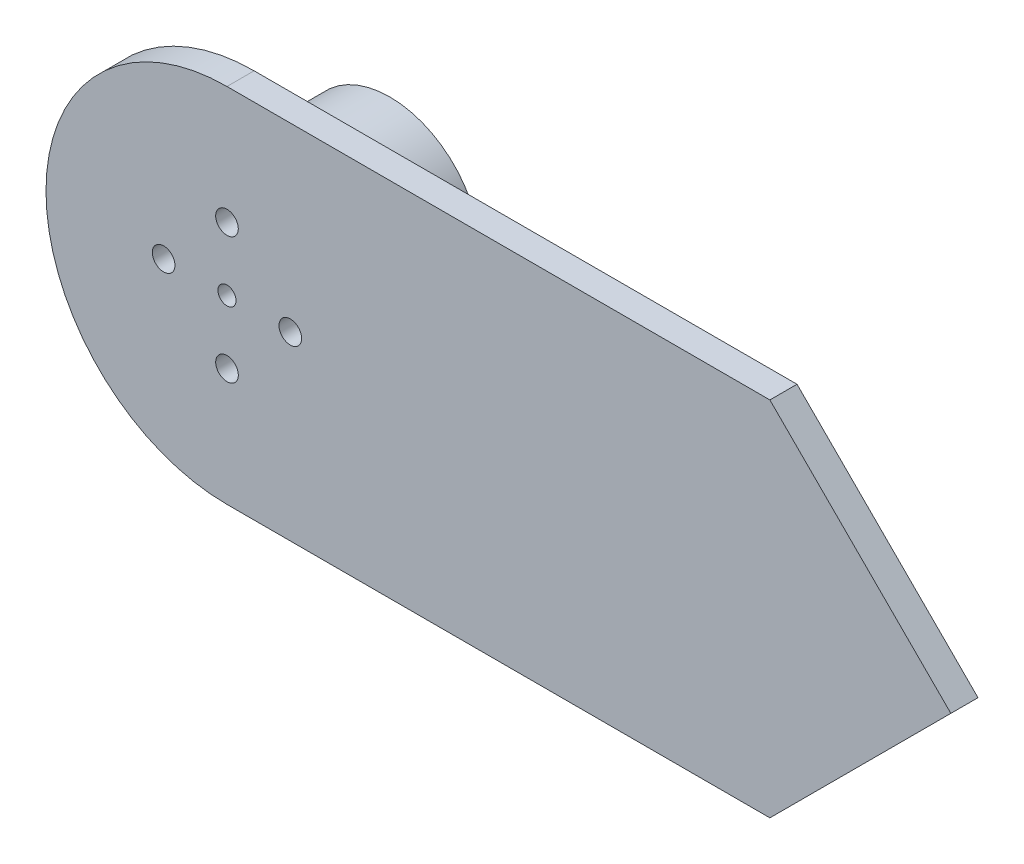
from build123d import *

# Parameters (mm, degrees)
BOSS_EXTRUDE1_DEPTH   = 3
CUT_EXTRUDE1_REACH    = 84.517
SKETCH2_R             = 1
SKETCH2_R_2           = 1.25
SKETCH3_R             = 10
BOSS_EXTRUDE2_DEPTH   = 15
BODY_MOVE_COPY2_ANGLE = 90


with BuildPart() as part:
    # Sketch1 → Boss-Extrude1 (new body)
    with BuildSketch(Plane(origin=(0, 0, 0), x_dir=(1, 0, 0), z_dir=(0, 1, 0))):
        with BuildLine():
            Line((60, -20), (0, -20))
            ThreePointArc((0, -20), (-20, 0), (0, 20))
            Line((0, 20), (60, 20))
            Line((60, 20), (80, 0))
            Line((80, 0), (60, -20))
        make_face()
    extrude(amount=BOSS_EXTRUDE1_DEPTH)

    # Sketch2 → Cut-Extrude1 (cut, up to next)
    with BuildSketch(Plane(origin=(0, 3, 0), x_dir=(1, 0, 0), z_dir=(0, 1, 0)), mode=Mode.PRIVATE) as cut_extrude1_sk1:
        with Locations(Location((0, 0, 0), (0, 0, 270))):
            Circle(SKETCH2_R)
    cut_extrude1_tool1 = extrude(cut_extrude1_sk1.sketch, amount=-CUT_EXTRUDE1_REACH, mode=Mode.PRIVATE) & part.part
    # Sketch2 → Cut-Extrude1 (cut, up to next)
    with BuildSketch(Plane(origin=(0, 3, 0), x_dir=(1, 0, 0), z_dir=(0, 1, 0)), mode=Mode.PRIVATE) as cut_extrude1_sk2:
        with Locations(Location((0, 7, 0), (0, 0, 270))):
            Circle(SKETCH2_R_2)
    cut_extrude1_tool2 = extrude(cut_extrude1_sk2.sketch, amount=-CUT_EXTRUDE1_REACH, mode=Mode.PRIVATE) & part.part
    # Sketch2 → Cut-Extrude1 (cut, up to next)
    with BuildSketch(Plane(origin=(0, 3, 0), x_dir=(1, 0, 0), z_dir=(0, 1, 0)), mode=Mode.PRIVATE) as cut_extrude1_sk3:
        with Locations(Location((7.001, 0.001, 0), (0, 0, 270))):
            Circle(SKETCH2_R_2)
    cut_extrude1_tool3 = extrude(cut_extrude1_sk3.sketch, amount=-CUT_EXTRUDE1_REACH, mode=Mode.PRIVATE) & part.part
    # Sketch2 → Cut-Extrude1 (cut, up to next)
    with BuildSketch(Plane(origin=(0, 3, 0), x_dir=(1, 0, 0), z_dir=(0, 1, 0)), mode=Mode.PRIVATE) as cut_extrude1_sk4:
        with Locations(Location((0.002, -7, 0), (0, 0, 270))):
            Circle(SKETCH2_R_2)
    cut_extrude1_tool4 = extrude(cut_extrude1_sk4.sketch, amount=-CUT_EXTRUDE1_REACH, mode=Mode.PRIVATE) & part.part
    # Sketch2 → Cut-Extrude1 (cut, up to next)
    with BuildSketch(Plane(origin=(0, 3, 0), x_dir=(1, 0, 0), z_dir=(0, 1, 0)), mode=Mode.PRIVATE) as cut_extrude1_sk5:
        with Locations(Location((-6.999, -0.001, 0), (0, 0, 270))):
            Circle(SKETCH2_R_2)
    cut_extrude1_tool5 = extrude(cut_extrude1_sk5.sketch, amount=-CUT_EXTRUDE1_REACH, mode=Mode.PRIVATE) & part.part
    add(cut_extrude1_tool1.solids().sort_by_distance((0, 3, 0))[0], mode=Mode.SUBTRACT)
    add(cut_extrude1_tool2.solids().sort_by_distance((0, 3, -7))[0], mode=Mode.SUBTRACT)
    add(cut_extrude1_tool3.solids().sort_by_distance((7.001, 3, -0.001))[0], mode=Mode.SUBTRACT)
    add(cut_extrude1_tool4.solids().sort_by_distance((0.002, 3, 7))[0], mode=Mode.SUBTRACT)
    add(cut_extrude1_tool5.solids().sort_by_distance((-6.999, 3, 0.001))[0], mode=Mode.SUBTRACT)

    # Sketch3 → Boss-Extrude2 (add)
    with BuildSketch(Plane.XZ):
        with Locations(Location((0, 0, 0), (0, 0, 90))):
            Circle(SKETCH3_R)
    extrude(amount=BOSS_EXTRUDE2_DEPTH)


with BuildPart() as part_1:
    # Body-Move/Copy2: moved
    add(part.part.rotate(Axis((0, 0, 0), (1, 0, 0)), BODY_MOVE_COPY2_ANGLE))


with BuildPart() as part_2:
    # Body-Move/Copy3: moved
    add(part_1.part.moved(Location((0, 0, -3))))


solid = part_2.part
